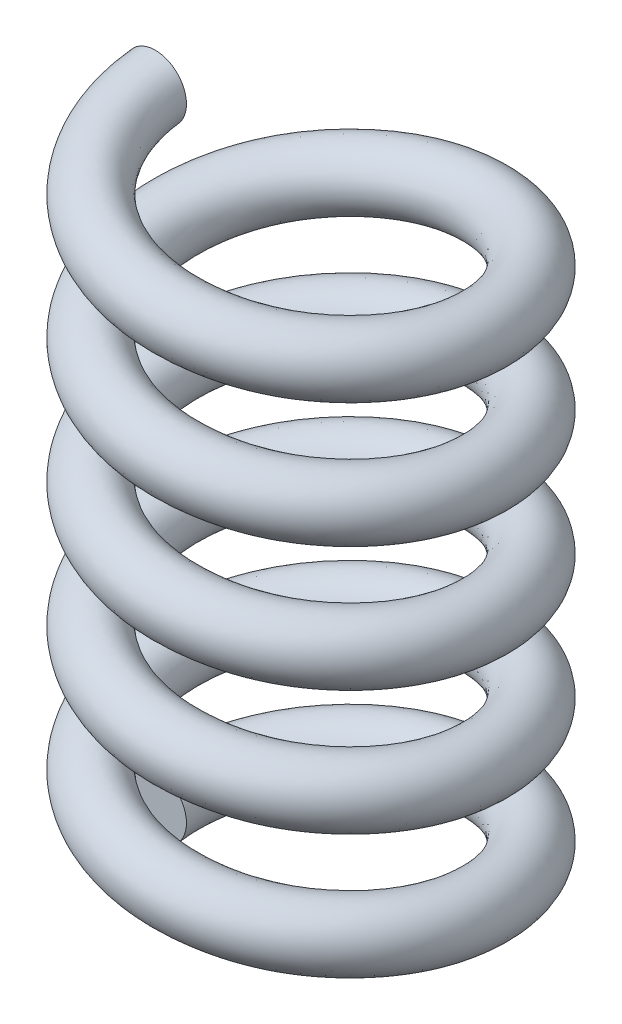
from build123d import *

# Parameters (mm, degrees)
SWEEP1_PITCH       = 1.6
SWEEP1_HEIGHT      = 8
SWEEP1_RADIUS      = 2
SWEEP1_START_ANGLE = -90
SKETCH2_R          = 0.4


with BuildPart() as part:
    # Sweep1: sweep along a helix
    with BuildLine() as sweep1_path:
        add(Helix(SWEEP1_PITCH, SWEEP1_HEIGHT, SWEEP1_RADIUS, center=(0, 0, 0), direction=(0, 1, 0), lefthand=True, mode=Mode.PRIVATE).rotate(Axis((0, 0, 0), (0, 1, 0)), SWEEP1_START_ANGLE))
    # Sketch2 → Sweep1 (sweep)
    with BuildSketch(Plane.XY):
        with Locations((-2, 0)):
            Circle(SKETCH2_R)
    sweep(path=sweep1_path.line, is_frenet=True)


solid = part.part
